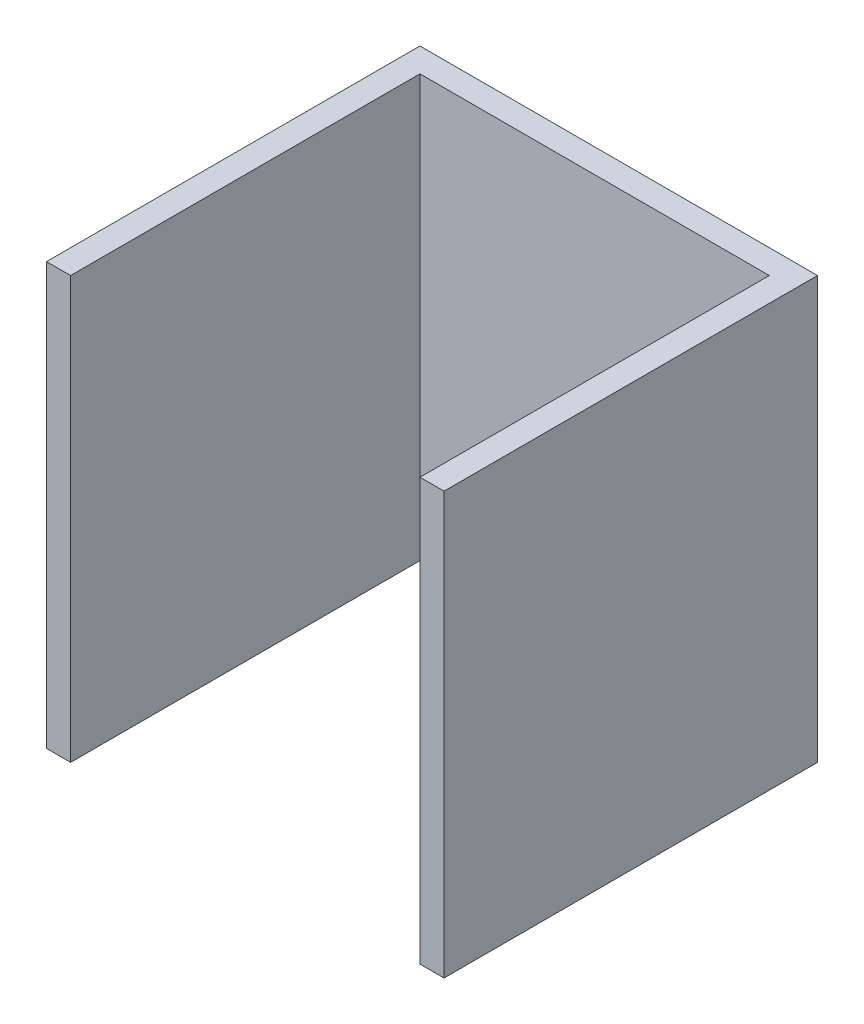
from build123d import *

# Parameters (mm, degrees)
BOSS_EXTRUDE1_DEPTH = 35


with BuildPart() as part:
    # Sketch1 → Boss-Extrude1 (new body)
    with BuildSketch(Plane(origin=(0, 0, 0), x_dir=(1, 0, 0), z_dir=(0, 1, 0))):
        Polygon((26.689969605, 5.301064411), (28.689969605, 5.301064411), (28.689969605, 36.301064411), (-4.310030395, 36.301064411), (-4.310030395, 5.301064411), (-2.310030395, 5.301064411), (-2.310030395, 34.301064411), (26.689969605, 34.301064411), align=None)
    extrude(amount=BOSS_EXTRUDE1_DEPTH)


solid = part.part
